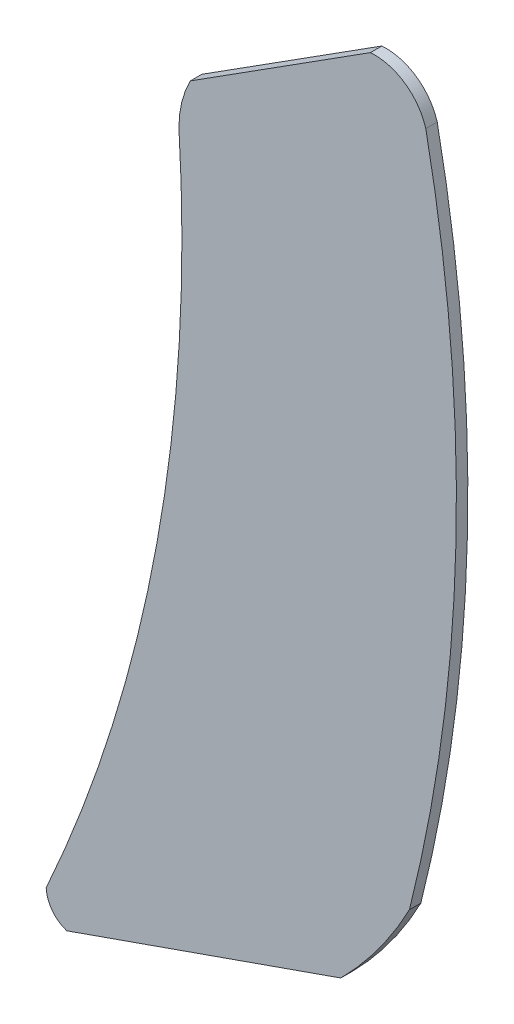
from build123d import *

# Parameters (mm, degrees)
EXTRUDE_1_DEPTH = 3


with BuildPart() as part:
    # Эскиз1 → Бобышка-Вытянуть1 (new body)
    with BuildSketch(Plane.XY):
        with BuildLine():
            ThreePointArc((71.910596806, 25.230232233), (89.617789367, 131.826316673), (79.68159846, 239.425303641))
            Line((79.68159846, 239.425303641), (32.429608738, 209.371194648))
            ThreePointArc((32.429608738, 209.371194648), (31.080732298, 102.87778502), (-3.3, 2.07782962))
            ThreePointArc((-3.3, 2.07782962), (-1.782749379, 0.828082821), (0, 0))
            Line((0, 0), (71.910596806, 25.230232233))
        make_face()
        with BuildLine():
            ThreePointArc((-3.3, 2.07782962), (31.080732298, 102.87778502), (32.429608738, 209.371194648))
            ThreePointArc((32.429608738, 209.371194648), (30.180601525, 203.45537675), (29.429608738, 197.171194648))
            ThreePointArc((29.429608738, 197.171194648), (23.664975471, 100.000760944), (-5.4, 7.1))
            ThreePointArc((-5.4, 7.1), (-4.805172006, 4.398586498), (-3.3, 2.07782962))
        make_face()
        with BuildLine():
            ThreePointArc((79.68159846, 239.425303641), (88.718866692, 237.000959513), (94.210596806, 229.425303641))
            ThreePointArc((94.210596806, 229.425303641), (102.133781486, 139.336722404), (89.910596806, 49.730232233))
            ThreePointArc((89.910596806, 49.730232233), (81.828404444, 36.80592458), (71.910596806, 25.230232233))
            ThreePointArc((71.910596806, 25.230232233), (89.617789367, 131.826316673), (79.68159846, 239.425303641))
        make_face()
    extrude(amount=EXTRUDE_1_DEPTH)


solid = part.part
